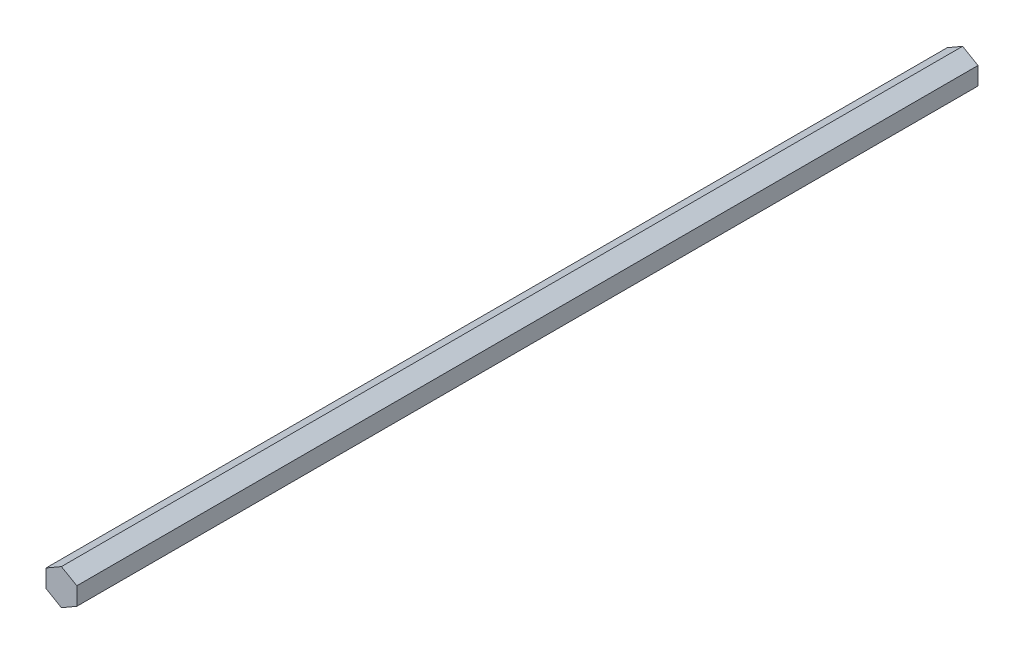
from build123d import *

# Parameters (mm, degrees)
BOSS_EXTRUDE2_DEPTH      = 152.4
BOSS_EXTRUDE2_DEPTH_BACK = 152.4
BOSS_EXTRUDE3_DEPTH      = 66.548


with BuildPart() as part:
    # Sketch3 → Boss-Extrude2 (new, two sides: drawn at the far end of the back side and taken through both)
    with BuildSketch(Plane.XY.offset(-BOSS_EXTRUDE2_DEPTH_BACK)):
        Polygon((-6.35, -3.666174209), (0, -7.332348419), (6.35, -3.666174209), (6.35, 3.666174209), (0, 7.332348419), (-6.35, 3.666174209), align=None)
    extrude(amount=BOSS_EXTRUDE2_DEPTH + BOSS_EXTRUDE2_DEPTH_BACK)

    # Sketch4 → Boss-Extrude3 (add)
    with BuildSketch(Plane.XY.offset(152.4)):
        Polygon((-6.35, 3.666174209), (-6.35, -3.666174209), (0, -7.332348419), (6.35, -3.666174209), (6.35, 3.666174209), (0, 7.332348419), align=None)
    extrude(amount=BOSS_EXTRUDE3_DEPTH)


solid = part.part
